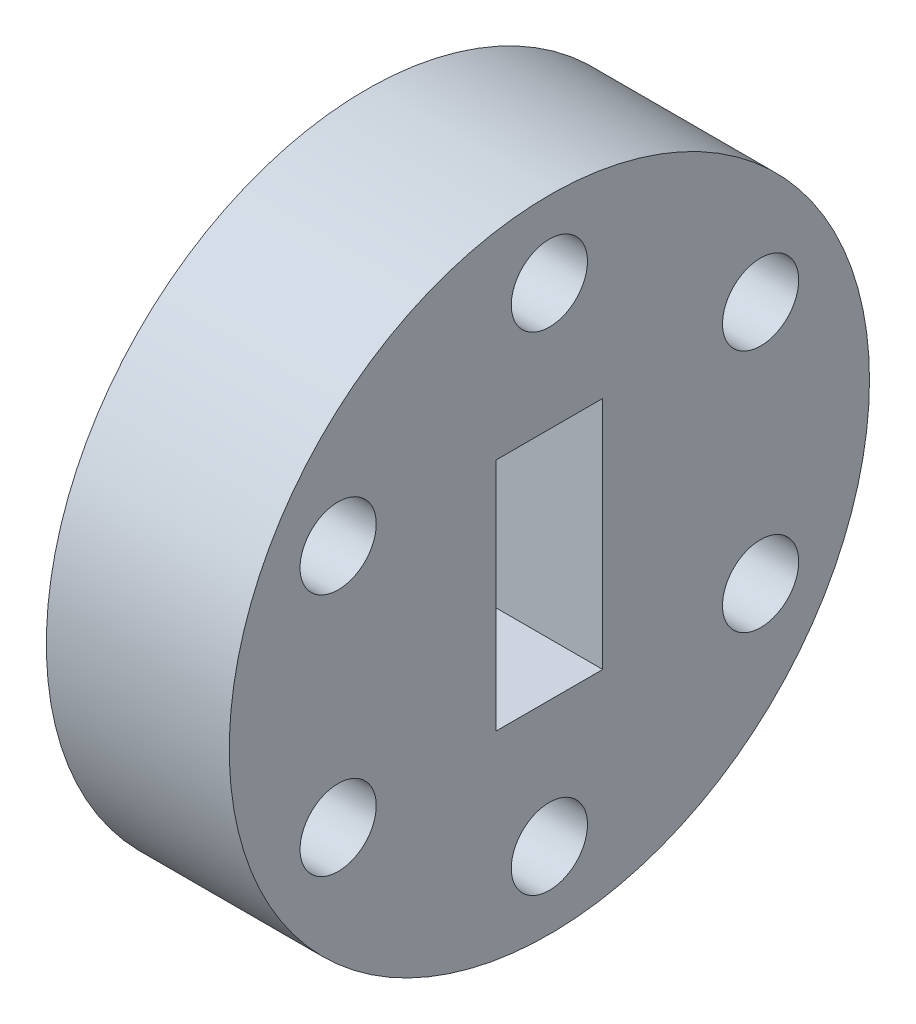
from build123d import *

# Parameters (mm, degrees)
SKETCH1_R           = 10.5
BOSS_EXTRUDE1_DEPTH = 6
SKETCH2_R           = 1.25
CUT_EXTRUDE1_DEPTH  = 17.015617378
SKETCH3_W           = 3.5
SKETCH3_H           = 7.7
CUT_EXTRUDE2_DEPTH  = 6


with BuildPart() as part:
    # Sketch1 → Boss-Extrude1 (new body)
    with BuildSketch(Plane(origin=(0, 0, 0), x_dir=(0, 0, -1), z_dir=(1, 0, 0))):
        Circle(SKETCH1_R)
    extrude(amount=BOSS_EXTRUDE1_DEPTH)

    # Sketch2 → Cut-Extrude1 (cut, through all)
    with BuildSketch(Plane(origin=(6, 0, 0), x_dir=(0, 0, -1), z_dir=(1, 0, 0))):
        with Locations((0, 8)):
            Circle(SKETCH2_R)
        with Locations((6.92820323, 4)):
            Circle(SKETCH2_R)
        with Locations((6.92820323, -4)):
            Circle(SKETCH2_R)
        with Locations((0, -8)):
            Circle(SKETCH2_R)
        with Locations((-6.92820323, -4)):
            Circle(SKETCH2_R)
        with Locations((-6.92820323, 4)):
            Circle(SKETCH2_R)
    extrude(amount=-CUT_EXTRUDE1_DEPTH, mode=Mode.SUBTRACT)

    # Sketch3 → Cut-Extrude2 (cut)
    with BuildSketch(Plane(origin=(6, 0, 0), x_dir=(0, 0, -1), z_dir=(1, 0, 0))):
        Rectangle(SKETCH3_W, SKETCH3_H)
    extrude(amount=-CUT_EXTRUDE2_DEPTH, mode=Mode.SUBTRACT)


solid = part.part
